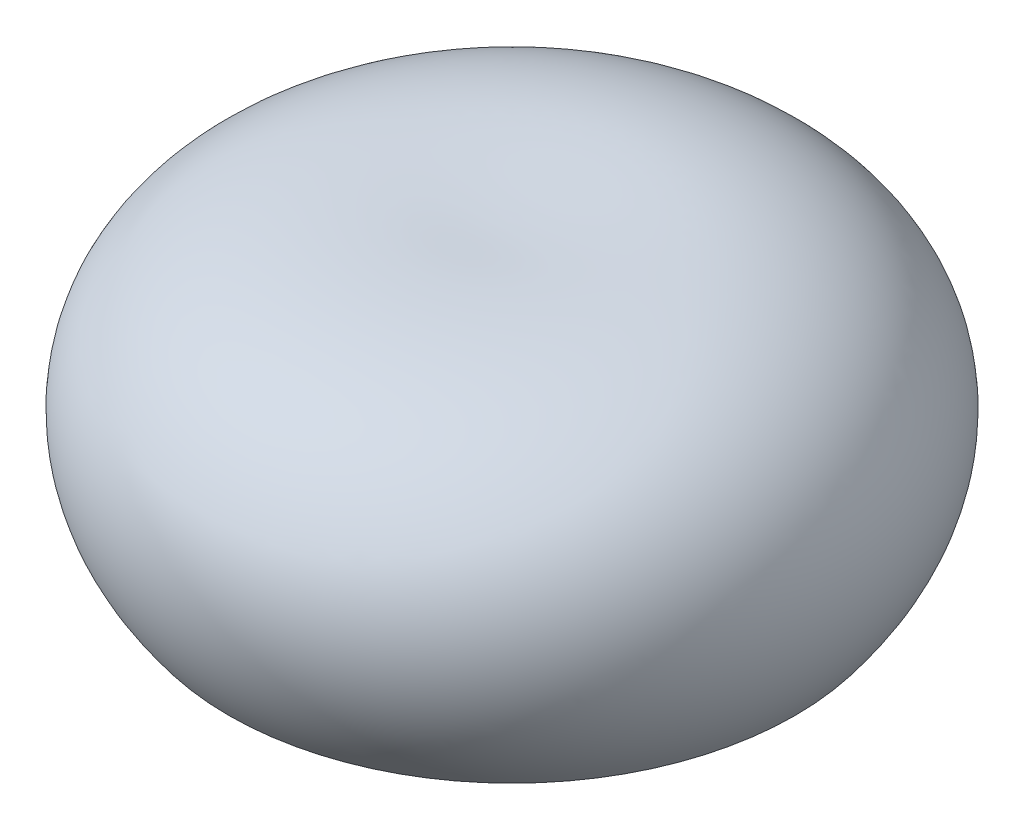
from build123d import *


with BuildPart() as part:
    # 草图1 → 旋转1 (revolve)
    with BuildSketch(Plane.XY):
        with BuildLine():
            Line((0, 7), (0, 0))
            Line((0, 0), (6.831441261, 0))
            add(Edge.make_bspline(
                [(0, 7), (0.073826027, 6.99961248), (0.178309524, 6.999064037), (0.306353289, 7.001245912), (0.380494798, 7.002863842), (0.441570297, 7.004497041), (0.495006805, 7.006121221), (0.543211062, 7.007739734), (0.587527277, 7.009349058), (0.628802834, 7.010947825), (0.667614606, 7.012534752), (0.704377034, 7.01410898), (0.739400045, 7.015669846), (0.772922733, 7.017216861), (0.805134201, 7.018749647), (0.83618711, 7.020267916), (0.866206819, 7.021771443), (0.895297775, 7.023260054), (0.923548095, 7.024733613), (0.951032931, 7.026192009), (0.977816991, 7.027635168), (1.003956462, 7.029063019), (1.029500501, 7.030475521), (1.054492406, 7.031872635), (1.078970545, 7.033254337), (1.10296911, 7.034620614), (1.126518722, 7.035971457), (1.149646932, 7.037306863), (1.172378634, 7.038626836), (1.194736407, 7.039931383), (1.216740809, 7.041220517), (1.238410615, 7.042494251), (1.25976303, 7.0437526), (1.280813862, 7.044995589), (1.301577678, 7.046223234), (1.322067936, 7.047435562), (1.342297094, 7.048632594), (1.362276717, 7.049814357), (1.382017559, 7.050980881), (1.401529643, 7.052132189), (1.420822325, 7.053268312), (1.439904357, 7.054389279), (1.458783938, 7.055495119), (1.477468763, 7.056585861), (1.495966064, 7.057661539), (1.514282646, 7.058722181), (1.532424926, 7.059767819), (1.550398957, 7.060798482), (1.568210462, 7.061814207), (1.585864853, 7.062815017), (1.603367259, 7.063800952), (1.62072254, 7.064772037), (1.637935314, 7.065728308), (1.655009966, 7.066669794), (1.671950667, 7.067596524), (1.68876139, 7.068508536), (1.705445919, 7.069405855), (1.722007866, 7.070288514), (1.738450677, 7.071156547), (1.754777643, 7.072009978), (1.770991912, 7.072848845), (1.787096497, 7.073673172), (1.803094282, 7.074482995), (1.81898803, 7.075278339), (1.834780391, 7.076059237), (1.850473907, 7.076825718), (1.86607102, 7.077577811), (1.881574075, 7.078315544), (1.896985327, 7.079038948), (1.912306943, 7.07974805), (1.927541011, 7.080442881), (1.94268954, 7.081123467), (1.957754466, 7.081789835), (1.972737654, 7.082442017), (1.987640906, 7.083080038), (2.002465956, 7.083703922), (2.017214482, 7.084313704), (2.031888102, 7.084909403), (2.046488381, 7.085491048), (2.06101683, 7.086058669), (2.075474911, 7.086612287), (2.089864039, 7.087151929), (2.104185584, 7.087677622), (2.118440871, 7.088189393), (2.132631183, 7.088687262), (2.146757765, 7.089171256), (2.160821822, 7.089641403), (2.174824525, 7.090097722), (2.188767006, 7.09054024), (2.202650367, 7.09096898), (2.216475676, 7.091383966), (2.23024397, 7.091785222), (2.243956256, 7.092172768), (2.257613513, 7.092546632), (2.271216693, 7.092906831), (2.284766719, 7.093253391), (2.298264492, 7.093586334), (2.311710885, 7.09390568), (2.32510675, 7.094211452), (2.338452915, 7.094503671), (2.351750186, 7.094782357), (2.364999348, 7.095047533), (2.378201166, 7.09529922), (2.391356385, 7.095537436), (2.404465731, 7.095762203), (2.417529911, 7.09597354), (2.430549615, 7.096171469), (2.443525516, 7.096356007), (2.45645827, 7.096527175), (2.469348518, 7.09668499), (2.482196883, 7.096829475), (2.495003975, 7.096960644), (2.50777039, 7.097078519), (2.520496708, 7.097183115), (2.533183498, 7.097274453), (2.545831313, 7.097352551), (2.558440695, 7.097417424), (2.571012173, 7.097469092), (2.583546264, 7.09750757), (2.596043474, 7.097532877), (2.608504298, 7.097545029), (2.620929218, 7.097544042), (2.633318709, 7.097529932), (2.64567323, 7.097502718), (2.657993237, 7.097462414), (2.67027917, 7.097409035), (2.682531464, 7.097342598), (2.694750544, 7.09726312), (2.706936823, 7.097170612), (2.719090708, 7.097065093), (2.731212598, 7.096946574), (2.743302883, 7.096815074), (2.755361945, 7.096670604), (2.767390158, 7.096513182), (2.779387888, 7.096342817), (2.791355496, 7.096159528), (2.803293333, 7.095963325), (2.815201745, 7.095754224), (2.827081071, 7.095532236), (2.838931641, 7.095297379), (2.850753782, 7.095049659), (2.862547814, 7.094789094), (2.874314048, 7.094515696), (2.886052794, 7.094229477), (2.89776435, 7.093930449), (2.909449014, 7.093618625), (2.921107076, 7.093294014), (2.932738821, 7.092956632), (2.944344528, 7.092606489), (2.955924471, 7.092243596), (2.967478921, 7.091867965), (2.979008141, 7.091479607), (2.990512392, 7.091078535), (3.001991929, 7.090664754), (3.013447002, 7.090238283), (3.024877857, 7.089799124), (3.036284736, 7.089347295), (3.047667878, 7.088882802), (3.059027515, 7.088405656), (3.070363877, 7.087915865), (3.081677189, 7.087413443), (3.092967672, 7.086898398), (3.104235546, 7.086370736), (3.115481023, 7.085830472), (3.126704315, 7.085277611), (3.137905628, 7.084712164), (3.149085165, 7.084134138), (3.160243127, 7.083543545), (3.171379711, 7.08294039), (3.18249511, 7.082324685), (3.193589514, 7.081696437), (3.204663111, 7.081055651), (3.215716085, 7.080402341), (3.226748617, 7.079736509), (3.237760886, 7.079058168), (3.248753066, 7.078367321), (3.25972533, 7.077663979), (3.270677849, 7.076948147), (3.28161079, 7.076219835), (3.292524317, 7.075479047), (3.303418592, 7.074725791), (3.314293774, 7.073960076), (3.325150021, 7.073181906), (3.335987487, 7.072391289), (3.346806324, 7.071588229), (3.357606682, 7.070772736), (3.368388709, 7.069944815), (3.379152549, 7.069104471), (3.389898346, 7.068251711), (3.40062624, 7.067386539), (3.411336371, 7.066508962), (3.422028874, 7.065618987), (3.432703885, 7.064716619), (3.443361536, 7.063801859), (3.454001959, 7.062874719), (3.46462528, 7.061935199), (3.475231627, 7.060983306), (3.485821126, 7.060019045), (3.496393899, 7.059042419), (3.506950067, 7.058053435), (3.51748975, 7.057052097), (3.528013066, 7.056038409), (3.53852013, 7.055012375), (3.549011057, 7.053973998), (3.559485961, 7.052923283), (3.569944951, 7.051860236), (3.580388137, 7.050784859), (3.590815628, 7.049697155), (3.60122753, 7.04859713), (3.611623946, 7.047484783), (3.622004982, 7.046360123), (3.632370739, 7.04522315), (3.642721317, 7.044073867), (3.653056816, 7.042912278), (3.663377333, 7.041738386), (3.673682964, 7.040552194), (3.683973805, 7.039353704), (3.694249949, 7.038142919), (3.704511488, 7.036919842), (3.714758514, 7.035684475), (3.724991116, 7.03443682), (3.735209383, 7.033176878), (3.745413403, 7.031904655), (3.75560326, 7.03062015), (3.765779041, 7.029323364), (3.775940829, 7.028014301), (3.786088707, 7.026692964), (3.796222756, 7.025359352), (3.806343057, 7.024013466), (3.816449688, 7.02265531), (3.826542729, 7.021284883), (3.836622256, 7.019902188), (3.846688346, 7.018507226), (3.856741073, 7.017099995), (3.866780512, 7.015680502), (3.876806735, 7.01424874), (3.886819815, 7.012804716), (3.896819824, 7.01134843), (3.90680683, 7.009879879), (3.916780903, 7.008399066), (3.926742113, 7.006905992), (3.936690524, 7.005400655), (3.946626205, 7.003883057), (3.956549222, 7.002353198), (3.966459637, 7.000811077), (3.976357517, 6.999256695), (3.986242922, 6.997690051), (3.996115917, 6.996111144), (4.005976561, 6.994519976), (4.015824916, 6.992916545), (4.02566104, 6.991300851), (4.035484994, 6.989672893), (4.045296834, 6.988032669), (4.055096619, 6.986380181), (4.064884405, 6.984715427), (4.074660248, 6.983038404), (4.084424202, 6.981349114), (4.094176323, 6.979647555), (4.103916663, 6.977933724), (4.113645276, 6.976207622), (4.123362214, 6.974469247), (4.133067528, 6.972718596), (4.142761269, 6.970955668), (4.152443487, 6.969180463), (4.162114232, 6.967392978), (4.171773552, 6.965593212), (4.181421496, 6.963781161), (4.191058111, 6.961956825), (4.200683444, 6.960120203), (4.210297541, 6.958271289), (4.219900448, 6.956410085), (4.229492209, 6.954536586), (4.239072869, 6.95265079), (4.248642473, 6.950752695), (4.258201062, 6.948842299), (4.267748681, 6.946919598), (4.277285369, 6.94498459), (4.286811171, 6.943037272), (4.296326125, 6.941077643), (4.305830272, 6.939105696), (4.315323653, 6.937121433), (4.324806306, 6.935124847), (4.334278271, 6.933115936), (4.343739584, 6.931094697), (4.353190285, 6.929061127), (4.36263041, 6.927015222), (4.372059995, 6.924956978), (4.381479078, 6.922886393), (4.390887692, 6.920803462), (4.400285874, 6.918708182), (4.409673658, 6.916600549), (4.419051079, 6.914480559), (4.42841817, 6.912348208), (4.437774964, 6.910203491), (4.447121494, 6.908046408), (4.456457791, 6.905876949), (4.465783889, 6.903695116), (4.475099817, 6.901500898), (4.484405608, 6.899294297), (4.493701291, 6.897075303), (4.502986897, 6.894843915), (4.512262455, 6.892600126), (4.521527995, 6.890343936), (4.530783544, 6.888075334), (4.540029131, 6.885794319), (4.549264784, 6.883500886), (4.55849053, 6.881195028), (4.567706398, 6.878876743), (4.576912412, 6.876546022), (4.5861086, 6.874202864), (4.595294987, 6.871847261), (4.604471599, 6.869479209), (4.61363846, 6.8670987), (4.622795596, 6.864705731), (4.63194303, 6.862300299), (4.641080787, 6.859882391), (4.65020889, 6.85745201), (4.659327362, 6.855009142), (4.668436227, 6.852553788), (4.677535505, 6.850085939), (4.686625221, 6.847605588), (4.695705394, 6.845112732), (4.704776047, 6.842607362), (4.713837201, 6.840089474), (4.722888876, 6.83755906), (4.731931092, 6.835016114), (4.740963871, 6.832460632), (4.74998723, 6.829892604), (4.75900119, 6.827312027), (4.768005769, 6.824718891), (4.777000986, 6.822113193), (4.785986859, 6.819494921), (4.794963407, 6.816864075), (4.803930647, 6.814220643), (4.812888596, 6.811564621), (4.821837272, 6.808895998), (4.830776691, 6.806214774), (4.839706869, 6.803520935), (4.848627822, 6.800814476), (4.857539568, 6.798095391), (4.866442119, 6.795363672), (4.875335493, 6.792619313), (4.884219704, 6.789862302), (4.893094767, 6.787092637), (4.901960695, 6.784310306), (4.910817504, 6.781515306), (4.919665205, 6.778707625), (4.928503814, 6.775887257), (4.937333343, 6.773054194), (4.946153805, 6.770208428), (4.954965213, 6.767349953), (4.963767579, 6.764478756), (4.972560915, 6.761594835), (4.981345232, 6.758698176), (4.990120543, 6.755788775), (4.998886858, 6.752866623), (5.007644188, 6.74993171), (5.016392546, 6.746984029), (5.025131939, 6.744023569), (5.033862379, 6.741050326), (5.042583876, 6.738064287), (5.051296439, 6.735065448), (5.060000077, 6.732053794), (5.068694801, 6.729029321), (5.077380618, 6.725992018), (5.086057538, 6.722941878), (5.094725569, 6.71987889), (5.103384718, 6.716803044), (5.112034995, 6.713714334), (5.120676405, 6.710612749), (5.129308958, 6.70749828), (5.137932659, 6.704370916), (5.146547516, 6.701230651), (5.155153537, 6.698077474), (5.163750726, 6.694911373), (5.17233909, 6.691732342), (5.180918636, 6.688540369), (5.189489369, 6.685335446), (5.198051295, 6.682117563), (5.206604418, 6.678886708), (5.215148744, 6.675642873), (5.223684278, 6.672386047), (5.232211025, 6.669116222), (5.240728988, 6.665833385), (5.249238171, 6.662537528), (5.25773858, 6.659228639), (5.266230218, 6.65590671), (5.274713087, 6.652571728), (5.283187193, 6.649223684), (5.291652536, 6.645862568), (5.300109121, 6.642488368), (5.308556949, 6.639101074), (5.316996024, 6.635700677), (5.325426348, 6.632287163), (5.333847922, 6.628860523), (5.342260749, 6.625420747), (5.350664829, 6.62196782), (5.359060165, 6.618501737), (5.367446757, 6.615022483), (5.375824607, 6.611530048), (5.384193715, 6.608024418), (5.392554082, 6.604505586), (5.400905709, 6.60097354), (5.409248594, 6.597428265), (5.417582739, 6.593869754), (5.425908142, 6.590297991), (5.434224804, 6.586712969), (5.442532724, 6.583114673), (5.450831901, 6.579503092), (5.459122334, 6.575878214), (5.467404022, 6.572240029), (5.475676964, 6.568588524), (5.483941157, 6.564923686), (5.492196599, 6.561245503), (5.50044329, 6.557553965), (5.508681226, 6.553849056), (5.516910406, 6.550130769), (5.525130826, 6.546399086), (5.533342485, 6.542653999), (5.541545379, 6.538895494), (5.549739504, 6.535123557), (5.557924857, 6.531338176), (5.566101436, 6.527539342), (5.574269235, 6.523727037), (5.582428252, 6.519901252), (5.590578482, 6.516061971), (5.598719922, 6.512209184), (5.606852565, 6.508342875), (5.61497641, 6.504463035), (5.623091449, 6.500569647), (5.631197678, 6.496662699), (5.639295091, 6.492742179), (5.647383684, 6.488808072), (5.655463452, 6.484860367), (5.663534387, 6.480899047), (5.671596486, 6.476924101), (5.679649739, 6.472935514), (5.687694144, 6.468933274), (5.695729692, 6.464917367), (5.703756377, 6.460887777), (5.711774192, 6.456844492), (5.71978313, 6.452787497), (5.727783185, 6.44871678), (5.735774348, 6.444632324), (5.743756613, 6.440534118), (5.751729971, 6.436422145), (5.759694415, 6.432296392), (5.767649937, 6.428156845), (5.775596528, 6.424003489), (5.783534181, 6.41983631), (5.791462886, 6.415655292), (5.799382636, 6.411460423), (5.807293419, 6.407251684), (5.81519523, 6.403029064), (5.823088058, 6.398792549), (5.830971892, 6.394542118), (5.838846725, 6.390277764), (5.846712546, 6.385999466), (5.854569345, 6.381707212), (5.862417112, 6.377400984), (5.870255837, 6.37308077), (5.878085509, 6.368746552), (5.885906118, 6.364398316), (5.893717654, 6.360036046), (5.901520105, 6.355659726), (5.90931346, 6.351269342), (5.917097708, 6.346864875), (5.924872839, 6.342446315), (5.932638837, 6.338013638), (5.940395695, 6.333566835), (5.948143398, 6.329105888), (5.955881936, 6.324630778), (5.963611296, 6.320141494), (5.971331465, 6.315638016), (5.97904243, 6.311120327), (5.98674418, 6.306588415), (5.994436701, 6.302042259), (6.002119979, 6.297481844), (6.009794004, 6.292907155), (6.017458758, 6.288318172), (6.02511423, 6.283714882), (6.032760407, 6.279097266), (6.040397273, 6.274465306), (6.048024816, 6.269818988), (6.05564302, 6.265158293), (6.06325187, 6.260483203), (6.070851354, 6.255793703), (6.078441456, 6.251089774), (6.08602216, 6.246371399), (6.093593452, 6.241638561), (6.101155317, 6.236891242), (6.108707739, 6.232129424), (6.116250702, 6.22735309), (6.123784191, 6.222562222), (6.13130819, 6.217756803), (6.138822681, 6.212936811), (6.146327653, 6.208102235), (6.153823082, 6.203253049), (6.161308958, 6.198389242), (6.16878526, 6.19351079), (6.176251974, 6.188617678), (6.183709081, 6.183709887), (6.191156565, 6.178787397), (6.198594407, 6.173850191), (6.206022591, 6.168898249), (6.213441098, 6.163931553), (6.220849911, 6.158950084), (6.228249012, 6.153953824), (6.235638381, 6.148942751), (6.243018001, 6.143916849), (6.250387854, 6.138876098), (6.25774792, 6.133820477), (6.26509818, 6.128749968), (6.272438616, 6.123664551), (6.279769208, 6.118564209), (6.287089935, 6.113448917), (6.294400781, 6.10831866), (6.301701724, 6.103173416), (6.308992744, 6.098013165), (6.316273821, 6.092837888), (6.323544934, 6.087647564), (6.330806063, 6.082442172), (6.33805719, 6.077221696), (6.345298289, 6.071986108), (6.352529345, 6.066735396), (6.359750331, 6.061469533), (6.36696123, 6.056188501), (6.374162017, 6.050892278), (6.381352675, 6.045580846), (6.388533176, 6.040254179), (6.395703504, 6.034912262), (6.402863633, 6.029555069), (6.410013542, 6.024182581), (6.417153208, 6.018794776), (6.424282608, 6.013391631), (6.431401721, 6.007973128), (6.438510521, 6.002539242), (6.445608988, 5.997089955), (6.452697094, 5.991625239), (6.459774821, 5.98614508), (6.466842141, 5.980649449), (6.473899031, 5.975138327), (6.480945468, 5.969611692), (6.487981427, 5.964069521), (6.495006884, 5.95851179), (6.502021813, 5.95293848), (6.50902619, 5.947349564), (6.51601999, 5.941745023), (6.523003188, 5.936124831), (6.529975758, 5.930488968), (6.536937674, 5.924837409), (6.543888912, 5.91917013), (6.550829444, 5.91348711), (6.557759247, 5.907788324), (6.56467829, 5.902073748), (6.57158655, 5.896343361), (6.578483999, 5.890597136), (6.585370611, 5.884835051), (6.592246357, 5.879057081), (6.599111213, 5.873263203), (6.605965148, 5.867453391), (6.612808137, 5.861627622), (6.619640151, 5.855785872), (6.626461162, 5.849928114), (6.633271142, 5.844054327), (6.640070062, 5.838164483), (6.646857895, 5.832258559), (6.65363461, 5.826336527), (6.66040018, 5.820398366), (6.667154576, 5.814444048), (6.673897766, 5.808473547), (6.680629723, 5.802486841), (6.687350415, 5.7964839), (6.694059815, 5.790464702), (6.700757891, 5.784429218), (6.707444612, 5.778377424), (6.714119949, 5.772309292), (6.72078387, 5.766224797), (6.727436346, 5.760123913), (6.734077343, 5.754006611), (6.740706832, 5.747872867), (6.747324779, 5.741722653), (6.753931155, 5.735555942), (6.760525926, 5.729372706), (6.767109061, 5.72317292), (6.773680527, 5.716956554), (6.780240291, 5.710723583), (6.786788322, 5.704473979), (6.793324585, 5.698207711), (6.799849047, 5.691924755), (6.806361676, 5.685625081), (6.812862436, 5.679308661), (6.819351296, 5.672975467), (6.82582822, 5.66662547), (6.832293173, 5.660258641), (6.838746122, 5.653874952), (6.845187032, 5.647474375), (6.851615868, 5.641056878), (6.858032594, 5.634622434), (6.864437176, 5.628171013), (6.870829578, 5.621702586), (6.877209762, 5.615217122), (6.883577694, 5.608714591), (6.889933338, 5.602194965), (6.896276656, 5.595658212), (6.902607613, 5.589104304), (6.908926169, 5.582533207), (6.915232291, 5.575944892), (6.921525938, 5.569339329), (6.927807074, 5.562716486), (6.93407566, 5.556076332), (6.940331659, 5.549418835), (6.946575032, 5.542743965), (6.95280574, 5.536051689), (6.959023744, 5.529341976), (6.965229006, 5.522614794), (6.971421487, 5.515870111), (6.977601144, 5.509107892), (6.983767942, 5.502328109), (6.989921836, 5.495530725), (6.996062789, 5.488715709), (7.00219076, 5.481883029), (7.008305706, 5.47503265), (7.014407587, 5.468164539), (7.020496364, 5.461278663), (7.026571991, 5.454374986), (7.03263443, 5.447453477), (7.038683638, 5.440514101), (7.04471957, 5.433556822), (7.050742184, 5.426581606), (7.056751441, 5.41958842), (7.062747294, 5.412577226), (7.0687297, 5.405547991), (7.074698615, 5.398500679), (7.080653997, 5.391435254), (7.086595799, 5.384351681), (7.092523978, 5.377249924), (7.09843849, 5.370129945), (7.104339288, 5.36299171), (7.110226328, 5.355835181), (7.116099562, 5.348660321), (7.121958947, 5.341467093), (7.127804434, 5.33425546), (7.133635978, 5.327025384), (7.139453534, 5.319776829), (7.145257051, 5.312509755), (7.151046484, 5.305224124), (7.156821783, 5.297919898), (7.162582904, 5.29059704), (7.168329793, 5.283255507), (7.174062407, 5.275895265), (7.179780693, 5.268516269), (7.185484603, 5.261118484), (7.19117409, 5.253701868), (7.196849099, 5.246266381), (7.202509584, 5.238811984), (7.208155493, 5.231338634), (7.213786775, 5.223846292), (7.219403379, 5.216334916), (7.225005254, 5.208804466), (7.230592346, 5.201254898), (7.236164607, 5.193686173), (7.24172198, 5.186098246), (7.247264415, 5.178491076), (7.252791858, 5.17086462), (7.258304256, 5.163218835), (7.263801554, 5.155553678), (7.269283698, 5.147869105), (7.274750635, 5.140165073), (7.280202309, 5.132441536), (7.285638665, 5.124698453), (7.291059647, 5.116935776), (7.296465199, 5.109153462), (7.301855266, 5.101351464), (7.307229789, 5.093529737), (7.312588712, 5.085688236), (7.31793198, 5.077826914), (7.323259529, 5.069945724), (7.328571308, 5.062044622), (7.333867255, 5.054123557), (7.339147311, 5.046182484), (7.344411415, 5.038221353), (7.349659511, 5.03024012), (7.354891536, 5.022238732), (7.360107432, 5.014217142), (7.365307135, 5.006175301), (7.370490586, 4.99811316), (7.375657723, 4.990030668), (7.380808483, 4.981927776), (7.385942803, 4.973804433), (7.39106062, 4.965660587), (7.396161874, 4.957496189), (7.401246496, 4.949311186), (7.406314425, 4.941105526), (7.411365595, 4.932879156), (7.416399942, 4.924632025), (7.4214174, 4.916364079), (7.426417902, 4.908075264), (7.431401383, 4.899765528), (7.436367773, 4.891434813), (7.441317009, 4.883083068), (7.44624902, 4.874710235), (7.451163738, 4.866316261), (7.456061095, 4.85790109), (7.460941021, 4.849464663), (7.465803446, 4.841006925), (7.470648302, 4.832527819), (7.475475515, 4.824027287), (7.480285016, 4.815505271), (7.485076733, 4.806961712), (7.48985059, 4.79839655), (7.494606521, 4.789809729), (7.499344447, 4.781201186), (7.504064297, 4.772570863), (7.508765993, 4.763918695), (7.513449467, 4.755244626), (7.518114636, 4.74654859), (7.522761429, 4.737830527), (7.527389767, 4.729090373), (7.531999574, 4.720328065), (7.536590772, 4.71154354), (7.541163283, 4.702736733), (7.545717027, 4.693907579), (7.550251926, 4.685056012), (7.5547679, 4.676181967), (7.559264867, 4.667285378), (7.563742748, 4.658366177), (7.568201459, 4.649424296), (7.572640919, 4.640459668), (7.577061042, 4.631472224), (7.581461751, 4.622461894), (7.585842955, 4.613428609), (7.590204571, 4.604372298), (7.594546516, 4.595292891), (7.5988687, 4.586190314), (7.603171038, 4.577064496), (7.607453444, 4.567915364), (7.611715826, 4.558742845), (7.615958098, 4.549546864), (7.620180171, 4.540327347), (7.624381949, 4.531084217), (7.628563348, 4.521817399), (7.632724272, 4.512526815), (7.63686463, 4.503212389), (7.640984331, 4.493874042), (7.645083274, 4.484511694), (7.649161372, 4.475125267), (7.653218524, 4.465714678), (7.657254638, 4.45627985), (7.661269612, 4.446820696), (7.665263355, 4.437337138), (7.66923576, 4.427829089), (7.673186735, 4.418296467), (7.677116175, 4.408739186), (7.68102398, 4.39915716), (7.68491005, 4.389550304), (7.688774278, 4.379918528), (7.692616567, 4.370261746), (7.696436804, 4.360579866), (7.700234889, 4.350872801), (7.704010715, 4.341140458), (7.707764174, 4.331382747), (7.711495158, 4.321599574), (7.715203559, 4.311790846), (7.718889263, 4.301956468), (7.722552163, 4.292096345), (7.726192146, 4.28221038), (7.729809098, 4.272298475), (7.733402908, 4.262360534), (7.736973454, 4.252396454), (7.740520629, 4.242406139), (7.744044308, 4.232389483), (7.747544379, 4.222346387), (7.751020719, 4.212276746), (7.754473208, 4.202180455), (7.757901727, 4.19205741), (7.76130615, 4.181907501), (7.764686357, 4.171730623), (7.76804222, 4.161526665), (7.771373615, 4.151295518), (7.774680415, 4.14103707), (7.77796249, 4.130751209), (7.781219711, 4.120437819), (7.784451948, 4.110096786), (7.787659069, 4.099727995), (7.79084094, 4.089331325), (7.793997427, 4.07890666), (7.797128393, 4.068453878), (7.800233702, 4.057972858), (7.803313213, 4.047463476), (7.80636679, 4.036925609), (7.809394288, 4.02635913), (7.812395566, 4.015763911), (7.815370481, 4.005139825), (7.818318884, 3.99448674), (7.821240631, 3.983804525), (7.824135572, 3.973093046), (7.827003555, 3.962352168), (7.829844432, 3.951581755), (7.832658048, 3.940781669), (7.835444246, 3.929951769), (7.838202873, 3.919091914), (7.84093377, 3.908201962), (7.843636775, 3.897281765), (7.846311728, 3.886331179), (7.848958465, 3.875350054), (7.851576822, 3.86433824), (7.854166632, 3.853295584), (7.856727724, 3.842221932), (7.859259931, 3.831117129), (7.861763079, 3.819981015), (7.864236993, 3.808813431), (7.866681497, 3.797614214), (7.869096413, 3.7863832), (7.87148156, 3.775120223), (7.873836757, 3.763825113), (7.876161817, 3.7524977), (7.878456556, 3.74113781), (7.880720784, 3.729745269), (7.882954312, 3.718319898), (7.885156942, 3.706861517), (7.887328483, 3.695369944), (7.889468735, 3.683844992), (7.891577499, 3.672286475), (7.893654571, 3.660694203), (7.895699747, 3.649067982), (7.897712819, 3.637407617), (7.899693575, 3.625712909), (7.901641805, 3.613983657), (7.903557292, 3.602219657), (7.905439817, 3.590420703), (7.907289162, 3.578586584), (7.9091051, 3.566717086), (7.910887405, 3.554811995), (7.912635851, 3.542871091), (7.914350199, 3.530894151), (7.91603022, 3.51888095), (7.917675669, 3.506831258), (7.91928631, 3.494744842), (7.920861894, 3.482621466), (7.922402172, 3.470460891), (7.923906896, 3.458262873), (7.925375808, 3.446027165), (7.92680865, 3.433753515), (7.928205158, 3.421441669), (7.92956507, 3.409091368), (7.930888111, 3.396702347), (7.93217401, 3.38427434), (7.93342249, 3.371807076), (7.934633269, 3.359300277), (7.935806061, 3.346753663), (7.936940577, 3.33416695), (7.93803652, 3.321539846), (7.939093596, 3.308872058), (7.940111499, 3.296163285), (7.941089923, 3.283413222), (7.942028554, 3.27062156), (7.942927078, 3.257787983), (7.943785171, 3.24491217), (7.944602506, 3.231993794), (7.945378752, 3.219032525), (7.946113571, 3.206028022), (7.946806622, 3.192979944), (7.947457556, 3.179887938), (7.948066016, 3.16675165), (7.948631649, 3.153570715), (7.949154083, 3.140344763), (7.949632952, 3.12707342), (7.950067874, 3.1137563), (7.950458468, 3.100393013), (7.950804339, 3.086983161), (7.951105095, 3.073526339), (7.951360327, 3.060022132), (7.951569625, 3.046470119), (7.951732574, 3.03286987), (7.95184874, 3.019220947), (7.951917698, 3.005522904), (7.951938999, 2.991775283), (7.951912198, 2.97797762), (7.951836834, 2.964129441), (7.951712443, 2.950230261), (7.951538547, 2.936279586), (7.951314664, 2.922276911), (7.951040298, 2.908221721), (7.950714946, 2.894113489), (7.950338097, 2.879951678), (7.949909224, 2.865735739), (7.949427798, 2.851465112), (7.948893271, 2.837139222), (7.948305089, 2.822757483), (7.947662685, 2.808319297), (7.946965479, 2.79382405), (7.946212881, 2.779271115), (7.945404291, 2.764659852), (7.944539088, 2.749989604), (7.943616644, 2.7352597), (7.942636317, 2.720469453), (7.941597449, 2.705618158), (7.940499368, 2.690705095), (7.939341388, 2.675729526), (7.938122804, 2.660690694), (7.936842898, 2.645587824), (7.935500935, 2.63042012), (7.934096162, 2.615186768), (7.932627806, 2.599886933), (7.931095082, 2.584519755), (7.929497177, 2.569084356), (7.927833264, 2.553579833), (7.926102496, 2.538005257), (7.924303998, 2.522359677), (7.922436881, 2.506642114), (7.920500227, 2.490851563), (7.918493099, 2.47498699), (7.91641453, 2.459047331), (7.914263532, 2.443031495), (7.912039084, 2.426938356), (7.909740147, 2.410766757), (7.90736564, 2.394515506), (7.904914466, 2.378183376), (7.902385483, 2.361769102), (7.899777529, 2.345271379), (7.897089394, 2.328688866), (7.894319846, 2.312020174), (7.891467606, 2.295263874), (7.888531363, 2.278418489), (7.885509757, 2.261482494), (7.882401395, 2.244454315), (7.879204834, 2.227332324), (7.875918587, 2.210114836), (7.872541115, 2.192800111), (7.86907083, 2.175386346), (7.865506094, 2.157871675), (7.861845206, 2.140254165), (7.858086412, 2.122531812), (7.854227894, 2.104702538), (7.850267765, 2.086764187), (7.846204078, 2.068714521), (7.842034806, 2.050551215), (7.837757848, 2.032271854), (7.833371027, 2.013873922), (7.828872075, 1.995354807), (7.824258639, 1.976711784), (7.819528268, 1.957942018), (7.814678413, 1.93904255), (7.809706418, 1.920010292), (7.804609514, 1.900842023), (7.79938481, 1.881534374), (7.794029295, 1.862083822), (7.788539812, 1.842486682), (7.782913068, 1.822739092), (7.777145613, 1.802837003), (7.771233831, 1.782776166), (7.765173932, 1.762552117), (7.758961935, 1.742160165), (7.752593661, 1.721595371), (7.746064711, 1.70085253), (7.73937045, 1.679926154), (7.732505999, 1.658810446), (7.725466197, 1.637499277), (7.718245598, 1.61598616), (7.710838434, 1.594264216), (7.70323859, 1.572326145), (7.695439582, 1.550164183), (7.68743451, 1.527770068), (7.679216032, 1.505134986), (7.670776315, 1.482249523), (7.662106992, 1.459103603), (7.653199103, 1.435686425), (7.644043042, 1.411986383), (7.634628477, 1.387990983), (7.624944284, 1.363686743), (7.614978446, 1.33905908), (7.604717954, 1.314092184), (7.594148689, 1.28876886), (7.583255271, 1.263070361), (7.572020914, 1.236976177), (7.560427217, 1.210463798), (7.548453948, 1.18350843), (7.536078766, 1.156082653), (7.52327691, 1.128156017), (7.510020795, 1.099694549), (7.496279544, 1.070660156), (7.482018409, 1.041009885), (7.467198033, 1.010695011), (7.451773557, 0.979659882), (7.43569345, 0.947840457), (7.418898027, 0.915162416), (7.401317504, 0.88153868), (7.382869392, 0.846866107), (7.363454982, 0.811020992), (7.342954436, 0.773852795), (7.321219775, 0.735175152), (7.298064541, 0.694752576), (7.273247917, 0.652279979), (7.246449153, 0.607349576), (7.217223809, 0.559393937), (7.184922391, 0.507579711), (7.148521469, 0.450584621), (7.106203239, 0.386040398), (7.053928975, 0.3085951), (6.962588145, 0.177853211), (6.88558457, 0.073425773), (6.831441261, 0)],
                knots=[0, 0, 0, 0, 0.016508251, 0.023363574, 0.028636216, 0.033091617, 0.037025983, 0.04059109, 0.04387702, 0.046942414, 0.049827967, 0.052563282, 0.055170689, 0.057667517, 0.060067538, 0.062381906, 0.064619804, 0.066788902, 0.068895681, 0.070945675, 0.072943656, 0.07489377, 0.076799649, 0.078664492, 0.080491139, 0.082282118, 0.084039697, 0.085765916, 0.087462619, 0.08913148, 0.090774023, 0.092391639, 0.093985605, 0.095557094, 0.097107186, 0.09863688, 0.1001471, 0.101638706, 0.103112495, 0.104569211, 0.10600955, 0.107434162, 0.108843656, 0.110238603, 0.111619541, 0.112986976, 0.114341384, 0.115683217, 0.117012898, 0.118330831, 0.119637397, 0.120932958, 0.122217857, 0.123492421, 0.12475696, 0.126011769, 0.127257131, 0.128493315, 0.129720577, 0.130939162, 0.132149305, 0.13335123, 0.134545153, 0.13573128, 0.136909808, 0.138080926, 0.139244818, 0.140401657, 0.141551613, 0.142694847, 0.143831516, 0.144961768, 0.14608575, 0.1472036, 0.148315453, 0.14942144, 0.150521684, 0.151616309, 0.15270543, 0.153789161, 0.154867612, 0.155940888, 0.157009093, 0.158072325, 0.159130682, 0.160184256, 0.161233138, 0.162277417, 0.163317176, 0.1643525, 0.165383468, 0.166410158, 0.167432647, 0.168451008, 0.169465312, 0.17047563, 0.17148203, 0.172484577, 0.173483335, 0.174478368, 0.175469736, 0.176457499, 0.177441714, 0.178422438, 0.179399726, 0.180373632, 0.181344207, 0.182311504, 0.183275571, 0.184236458, 0.185194213, 0.18614888, 0.187100506, 0.188049136, 0.188994811, 0.189937576, 0.19087747, 0.191814535, 0.192748809, 0.193680333, 0.194609143, 0.195535276, 0.19645877, 0.197379659, 0.198297978, 0.199213761, 0.200127042, 0.201037853, 0.201946226, 0.202852193, 0.203755784, 0.204657029, 0.205555959, 0.206452602, 0.207346986, 0.208239139, 0.209129089, 0.210016863, 0.210902486, 0.211785985, 0.212667385, 0.213546711, 0.214423987, 0.215299238, 0.216172487, 0.217043757, 0.217913071, 0.218780451, 0.219645919, 0.220509497, 0.221371207, 0.222231068, 0.223089102, 0.223945328, 0.224799767, 0.225652438, 0.22650336, 0.227352552, 0.228200033, 0.22904582, 0.229889932, 0.230732387, 0.231573202, 0.232412394, 0.23324998, 0.234085976, 0.234920399, 0.235753266, 0.236584591, 0.237414391, 0.23824268, 0.239069475, 0.23989479, 0.240718639, 0.241541037, 0.242361999, 0.243181539, 0.24399967, 0.244816406, 0.245631761, 0.246445748, 0.247258379, 0.248069669, 0.248879629, 0.249688273, 0.250495612, 0.251301659, 0.252106427, 0.252909926, 0.253712168, 0.254513166, 0.255312931, 0.256111473, 0.256908805, 0.257704937, 0.25849988, 0.259293644, 0.260086241, 0.26087768, 0.261667972, 0.262457128, 0.263245156, 0.264032068, 0.264817873, 0.265602581, 0.266386201, 0.267168742, 0.267950215, 0.268730627, 0.26950999, 0.27028831, 0.271065598, 0.271841862, 0.272617111, 0.273391353, 0.274164597, 0.274936852, 0.275708125, 0.276478425, 0.277247759, 0.278016137, 0.278783566, 0.279550053, 0.280315607, 0.281080235, 0.281843945, 0.282606744, 0.283368639, 0.284129639, 0.28488975, 0.28564898, 0.286407335, 0.287164823, 0.287921451, 0.288677225, 0.289432153, 0.290186241, 0.290939495, 0.291691923, 0.292443531, 0.293194325, 0.293944313, 0.294693499, 0.295441891, 0.296189495, 0.296936317, 0.297682363, 0.298427639, 0.29917215, 0.299915904, 0.300658906, 0.301401162, 0.302142677, 0.302883457, 0.303623508, 0.304362835, 0.305101445, 0.305839342, 0.306576532, 0.30731302, 0.308048812, 0.308783913, 0.309518328, 0.310252063, 0.310985123, 0.311717512, 0.312449236, 0.3131803, 0.313910709, 0.314640467, 0.31536958, 0.316098053, 0.316825891, 0.317553097, 0.318279677, 0.319005636, 0.319730978, 0.320455708, 0.321179831, 0.32190335, 0.322626271, 0.323348598, 0.324070336, 0.324791488, 0.32551206, 0.326232055, 0.326951478, 0.327670332, 0.328388624, 0.329106355, 0.329823532, 0.330540157, 0.331256236, 0.331971771, 0.332686767, 0.333401229, 0.334115159, 0.334828562, 0.335541443, 0.336253804, 0.33696565, 0.337676984, 0.338387811, 0.339098134, 0.339807957, 0.340517283, 0.341226117, 0.341934462, 0.342642321, 0.343349699, 0.344056599, 0.344763024, 0.345468979, 0.346174466, 0.346879489, 0.347584052, 0.348288158, 0.34899181, 0.349695012, 0.350397768, 0.351100081, 0.351801953, 0.352503389, 0.353204392, 0.353904965, 0.354605111, 0.355304834, 0.356004137, 0.356703023, 0.357401495, 0.358099556, 0.35879721, 0.35949446, 0.360191309, 0.360887759, 0.361583815, 0.362279479, 0.362974754, 0.363669643, 0.36436415, 0.365058277, 0.365752027, 0.366445403, 0.367138409, 0.367831047, 0.36852332, 0.369215231, 0.369906783, 0.370597978, 0.37128882, 0.371979312, 0.372669456, 0.373359255, 0.374048713, 0.374737831, 0.375426612, 0.37611506, 0.376803177, 0.377490966, 0.37817843, 0.378865571, 0.379552391, 0.380238895, 0.380925084, 0.381610961, 0.382296529, 0.38298179, 0.383666747, 0.384351403, 0.385035761, 0.385719822, 0.386403589, 0.387087066, 0.387770254, 0.388453157, 0.389135776, 0.389818115, 0.390500176, 0.391181961, 0.391863473, 0.392544714, 0.393225687, 0.393906395, 0.39458684, 0.395267024, 0.39594695, 0.39662662, 0.397306037, 0.397985203, 0.398664121, 0.399342793, 0.400021221, 0.400699408, 0.401377357, 0.402055069, 0.402732547, 0.403409794, 0.404086811, 0.404763602, 0.405440168, 0.406116513, 0.406792637, 0.407468544, 0.408144236, 0.408819716, 0.409494985, 0.410170046, 0.410844901, 0.411519553, 0.412194003, 0.412868255, 0.41354231, 0.414216171, 0.41488984, 0.415563319, 0.416236611, 0.416909718, 0.417582642, 0.418255385, 0.41892795, 0.419600339, 0.420272553, 0.420944597, 0.42161647, 0.422288177, 0.422959719, 0.423631098, 0.424302316, 0.424973377, 0.425644281, 0.426315032, 0.426985631, 0.42765608, 0.428326383, 0.42899654, 0.429666555, 0.430336429, 0.431006165, 0.431675764, 0.43234523, 0.433014564, 0.433683769, 0.434352845, 0.435021797, 0.435690626, 0.436359334, 0.437027923, 0.437696396, 0.438364755, 0.439033001, 0.439701138, 0.440369167, 0.44103709, 0.44170491, 0.442372628, 0.443040248, 0.443707771, 0.444375199, 0.445042534, 0.445709779, 0.446376936, 0.447044007, 0.447710995, 0.4483779, 0.449044726, 0.449711475, 0.450378149, 0.451044749, 0.451711279, 0.452377741, 0.453044136, 0.453710466, 0.454376735, 0.455042944, 0.455709095, 0.456375191, 0.457041233, 0.457707224, 0.458373167, 0.459039062, 0.459704913, 0.460370722, 0.46103649, 0.461702221, 0.462367916, 0.463033577, 0.463699207, 0.464364808, 0.465030382, 0.465695931, 0.466361458, 0.467026964, 0.467692453, 0.468357925, 0.469023384, 0.469688832, 0.47035427, 0.471019702, 0.471685129, 0.472350554, 0.473015978, 0.473681405, 0.474346836, 0.475012273, 0.47567772, 0.476343178, 0.477008649, 0.477674136, 0.478339641, 0.479005166, 0.479670714, 0.480336286, 0.481001886, 0.481667516, 0.482333177, 0.482998872, 0.483664604, 0.484330375, 0.484996187, 0.485662042, 0.486327943, 0.486993892, 0.487659892, 0.488325944, 0.488992052, 0.489658218, 0.490324443, 0.490990731, 0.491657084, 0.492323504, 0.492989993, 0.493656555, 0.494323191, 0.494989904, 0.495656696, 0.49632357, 0.496990528, 0.497657573, 0.498324707, 0.498991932, 0.499659252, 0.500326668, 0.500994183, 0.5016618, 0.502329521, 0.502997348, 0.503665285, 0.504333333, 0.505001496, 0.505669775, 0.506338174, 0.507006695, 0.50767534, 0.508344112, 0.509013014, 0.509682049, 0.510351218, 0.511020525, 0.511689972, 0.512359562, 0.513029297, 0.513699181, 0.514369215, 0.515039403, 0.515709747, 0.516380251, 0.517050916, 0.517721745, 0.518392742, 0.519063908, 0.519735248, 0.520406763, 0.521078456, 0.52175033, 0.522422388, 0.523094633, 0.523767067, 0.524439694, 0.525112516, 0.525785536, 0.526458757, 0.527132183, 0.527805815, 0.528479657, 0.529153711, 0.529827982, 0.530502471, 0.531177181, 0.531852116, 0.532527279, 0.533202673, 0.5338783, 0.534554164, 0.535230268, 0.535906615, 0.536583208, 0.53726005, 0.537937144, 0.538614493, 0.539292101, 0.539969971, 0.540648106, 0.541326508, 0.542005183, 0.542684131, 0.543363358, 0.544042865, 0.544722657, 0.545402737, 0.546083107, 0.546763772, 0.547444735, 0.548125999, 0.548807567, 0.549489443, 0.55017163, 0.550854132, 0.551536953, 0.552220095, 0.552903562, 0.553587358, 0.554271486, 0.55495595, 0.555640753, 0.5563259, 0.557011393, 0.557697236, 0.558383433, 0.559069988, 0.559756904, 0.560444185, 0.561131835, 0.561819858, 0.562508256, 0.563197035, 0.563886198, 0.564575749, 0.565265692, 0.56595603, 0.566646768, 0.567337909, 0.568029458, 0.568721418, 0.569413794, 0.570106589, 0.570799808, 0.571493455, 0.572187533, 0.572882048, 0.573577002, 0.574272401, 0.574968249, 0.575664549, 0.576361306, 0.577058525, 0.57775621, 0.578454364, 0.579152994, 0.579852102, 0.580551693, 0.581251772, 0.581952344, 0.582653412, 0.583354982, 0.584057058, 0.584759644, 0.585462746, 0.586166368, 0.586870514, 0.58757519, 0.5882804, 0.588986149, 0.589692442, 0.590399283, 0.591106678, 0.591814632, 0.592523149, 0.593232235, 0.593941895, 0.594652133, 0.595362955, 0.596074366, 0.596786371, 0.597498975, 0.598212184, 0.598926003, 0.599640438, 0.600355493, 0.601071174, 0.601787486, 0.602504436, 0.603222028, 0.603940268, 0.604659162, 0.605378715, 0.606098933, 0.606819822, 0.607541388, 0.608263636, 0.608986572, 0.609710203, 0.610434533, 0.61115957, 0.611885319, 0.612611786, 0.613338978, 0.6140669, 0.61479556, 0.615524962, 0.616255114, 0.616986021, 0.617717691, 0.61845013, 0.619183344, 0.619917339, 0.620652124, 0.621387703, 0.622124085, 0.622861275, 0.623599281, 0.624338109, 0.625077767, 0.625818261, 0.626559598, 0.627301787, 0.628044833, 0.628788745, 0.629533529, 0.630279192, 0.631025743, 0.631773189, 0.632521537, 0.633270795, 0.634020971, 0.634772072, 0.635524106, 0.636277082, 0.637031006, 0.637785888, 0.638541735, 0.639298555, 0.640056357, 0.640815149, 0.641574939, 0.642335736, 0.643097548, 0.643860385, 0.644624254, 0.645389164, 0.646155124, 0.646922144, 0.647690232, 0.648459398, 0.649229649, 0.650000997, 0.65077345, 0.651547017, 0.652321708, 0.653097533, 0.653874501, 0.654652623, 0.655431908, 0.656212365, 0.656994006, 0.657776841, 0.658560879, 0.659346131, 0.660132607, 0.660920319, 0.661709277, 0.662499491, 0.663290972, 0.664083733, 0.664877782, 0.665673133, 0.666469796, 0.667267783, 0.668067105, 0.668867774, 0.669669802, 0.670473201, 0.671277983, 0.67208416, 0.672891744, 0.673700749, 0.674511186, 0.675323068, 0.676136408, 0.67695122, 0.677767515, 0.678585309, 0.679404613, 0.680225443, 0.68104781, 0.68187173, 0.682697217, 0.683524283, 0.684352945, 0.685183217, 0.686015112, 0.686848647, 0.687683836, 0.688520694, 0.689359237, 0.690199481, 0.69104144, 0.691885132, 0.692730572, 0.693577776, 0.694426762, 0.695277545, 0.696130143, 0.696984574, 0.697840853, 0.698699, 0.699559031, 0.700420965, 0.70128482, 0.702150614, 0.703018367, 0.703888097, 0.704759824, 0.705633566, 0.706509344, 0.707387177, 0.708267086, 0.709149092, 0.710033215, 0.710919476, 0.711807896, 0.712698498, 0.713591303, 0.714486333, 0.715383612, 0.716283161, 0.717185005, 0.718089166, 0.718995668, 0.719904537, 0.720815795, 0.721729469, 0.722645583, 0.723564164, 0.724485237, 0.725408828, 0.726334966, 0.727263675, 0.728194986, 0.729128925, 0.730065521, 0.731004803, 0.7319468, 0.732891544, 0.733839062, 0.734789388, 0.735742552, 0.736698585, 0.737657521, 0.738619392, 0.739584232, 0.740552074, 0.741522955, 0.742496908, 0.743473969, 0.744454175, 0.745437564, 0.746424172, 0.747414039, 0.748407202, 0.749403704, 0.750403582, 0.75140688, 0.752413639, 0.753423901, 0.754437711, 0.755455113, 0.756476152, 0.757500875, 0.758529328, 0.759561559, 0.760597618, 0.761637555, 0.762681419, 0.763729264, 0.764781142, 0.765837108, 0.766897216, 0.767961524, 0.769030088, 0.770102968, 0.771180223, 0.772261915, 0.773348108, 0.774438865, 0.775534251, 0.776634335, 0.777739184, 0.778848869, 0.779963461, 0.781083035, 0.782207666, 0.783337431, 0.784472409, 0.785612681, 0.786758331, 0.787909442, 0.789066103, 0.790228404, 0.791396435, 0.792570292, 0.793750071, 0.794935871, 0.796127795, 0.797325948, 0.798530437, 0.799741374, 0.800958872, 0.802183049, 0.803414025, 0.804651926, 0.805896879, 0.807149016, 0.808408474, 0.809675392, 0.810949915, 0.812232194, 0.813522381, 0.814820636, 0.816127124, 0.817442016, 0.818765486, 0.820097718, 0.8214389, 0.822789227, 0.824148902, 0.825518134, 0.826897142, 0.828286152, 0.829685398, 0.831095124, 0.832515586, 0.833947046, 0.835389779, 0.836844074, 0.838310228, 0.839788554, 0.841279378, 0.84278304, 0.844299896, 0.84583032, 0.847374703, 0.848933455, 0.850507006, 0.852095808, 0.853700338, 0.855321097, 0.856958612, 0.858613442, 0.860286175, 0.861977436, 0.863687885, 0.865418223, 0.867169194, 0.868941592, 0.87073626, 0.872554101, 0.874396079, 0.876263228, 0.878156657, 0.880077562, 0.88202723, 0.884007054, 0.886018541, 0.888063331, 0.890143212, 0.892260136, 0.894416246, 0.896613899, 0.898855701, 0.901144543, 0.903483648, 0.905876625, 0.908327542, 0.910841004, 0.913422269, 0.916077374, 0.918813316, 0.921638278, 0.924561926, 0.927595825, 0.930754002, 0.934053748, 0.937516794, 0.9411711, 0.945053679, 0.94921533, 0.953729132, 0.958707135, 0.964337724, 0.970987573, 0.979600573, 1, 1, 1, 1], degree=3))
        make_face()
    revolve(axis=Axis((0, 7, 0), (0, -1, 0)))

    # 草图2 → 切除-旋转1 (revolve, cut)
    with BuildSketch(Plane.XZ):
        with BuildLine():
            Line((0, 5), (0, -5))
            ThreePointArc((0, -5), (5, 0), (0, 5))
        make_face()
    revolve(axis=Axis((0, 0, 5), (0, 0, -1)), mode=Mode.SUBTRACT)


solid = part.part
